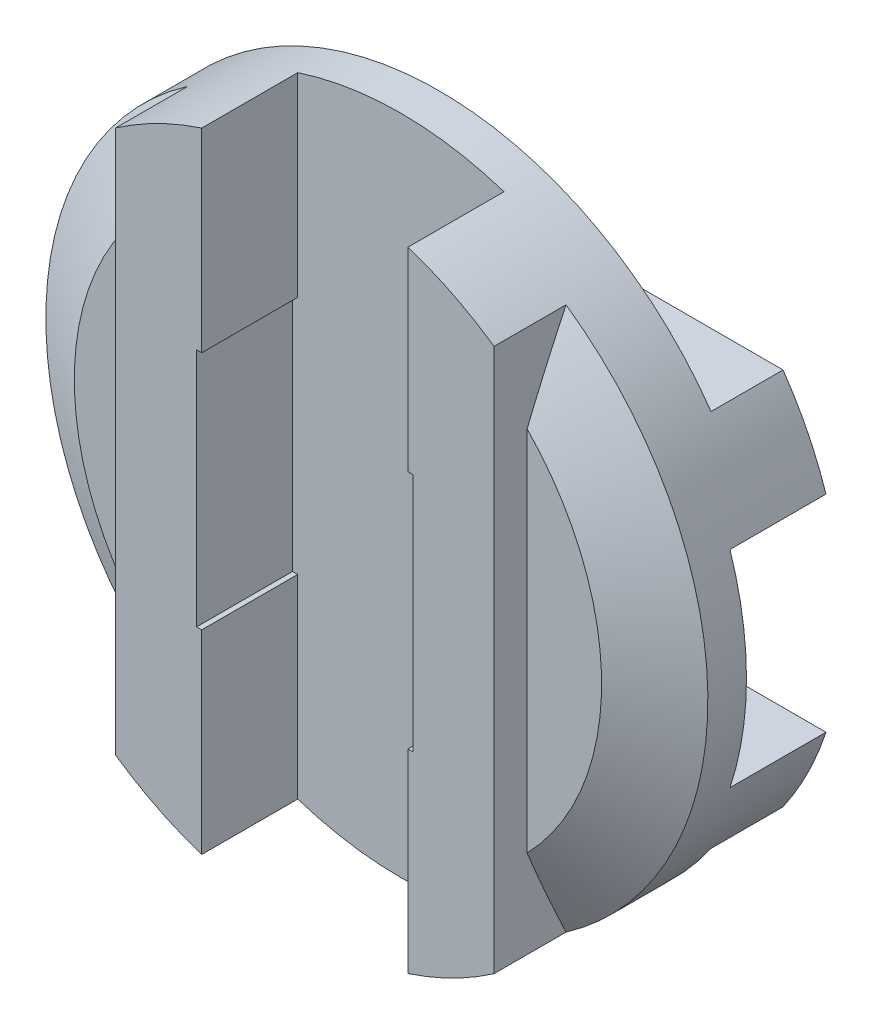
from build123d import *
from OCP.BRepFilletAPI import BRepFilletAPI_MakeChamfer

# Parameters (mm, degrees)
SKETCH1_R           = 12.7
BOSS_EXTRUDE1_DEPTH = 3.9624
SKETCH2_W           = 7.9121
SKETCH2_H           = 25.4
CUT_EXTRUDE1_DEPTH  = 3.683
SKETCH3_W           = 25.4
SKETCH3_H           = 7.9121
CUT_EXTRUDE2_DEPTH  = 3.683
SKETCH4_W           = 5.44195
SKETCH4_H           = 25.4
CUT_EXTRUDE3_DEPTH  = 1.27
SKETCH5_W           = 25.4
SKETCH5_H           = 5.44195
CUT_EXTRUDE4_DEPTH  = 1.27
CHAMFER1_SIZE       = 2.58492625
CHAMFER1_SIZE2      = 1.492407866
SKETCH6_W           = 8.307705
SKETCH6_H           = 9.2075
CUT_EXTRUDE5_DEPTH  = 3.683
SKETCH7_W           = 9.2075
SKETCH7_H           = 8.307705
CUT_EXTRUDE6_DEPTH  = 3.683


with BuildPart() as part:
    # Sketch1 → Boss-Extrude1 (new, symmetric)
    with BuildSketch(Plane.XY):
        Circle(SKETCH1_R)
    extrude(amount=BOSS_EXTRUDE1_DEPTH, both=True)

    # Sketch2 → Cut-Extrude1 (cut)
    with BuildSketch(Plane.XY.offset(3.9624)):
        Rectangle(SKETCH2_W, SKETCH2_H)
    extrude(amount=-CUT_EXTRUDE1_DEPTH, mode=Mode.SUBTRACT)

    # Sketch3 → Cut-Extrude2 (cut)
    with BuildSketch(Plane(origin=(0, 0, -3.9624), x_dir=(-1, 0, 0), z_dir=(0, 0, -1))):
        Rectangle(SKETCH3_W, SKETCH3_H)
    extrude(amount=-CUT_EXTRUDE2_DEPTH, mode=Mode.SUBTRACT)

    # Sketch4 → Cut-Extrude3 (cut)
    with BuildSketch(Plane.XY.offset(3.9624)):
        with Locations((9.979025, 0)):
            Rectangle(SKETCH4_W, SKETCH4_H)
        with Locations((-9.979025, 0)):
            Rectangle(SKETCH4_W, SKETCH4_H)
    extrude(amount=-CUT_EXTRUDE3_DEPTH, mode=Mode.SUBTRACT)

    # Sketch5 → Cut-Extrude4 (cut)
    with BuildSketch(Plane(origin=(0, 0, -3.9624), x_dir=(-1, 0, 0), z_dir=(0, 0, -1))):
        with Locations((0, 9.979025)):
            Rectangle(SKETCH5_W, SKETCH5_H)
        with Locations((0, -9.979025)):
            Rectangle(SKETCH5_W, SKETCH5_H)
    extrude(amount=-CUT_EXTRUDE4_DEPTH, mode=Mode.SUBTRACT)

    # Chamfer1: one chamfer whose edges measure the first distance from different faces: ONE call of the kernel's chamfer builder (chamfer() names one face for all edges)
    chamfer1_edges_1 = [part.edges().sort_by_distance(p)[0] for p in [
        (0, 12.7, -2.6924),
    ]]
    chamfer1_side_1 = [part.faces().sort_by_distance(p)[0] for p in [
        (0, 9.480522033, -2.6924),
    ]]
    chamfer1_edges_2 = [part.edges().sort_by_distance(p)[0] for p in [
        (0, -12.7, -2.6924),
    ]]
    chamfer1_side_2 = [part.faces().sort_by_distance(p)[0] for p in [
        (0, -9.480522033, -2.6924),
    ]]
    chamfer1_edges_3 = [part.edges().sort_by_distance(p)[0] for p in [
        (11.257602653, -5.8784677, 2.6924),
    ]]
    chamfer1_side_3 = [part.faces().sort_by_distance(p)[0] for p in [
        (9.480522033, 0, 2.6924),
    ]]
    chamfer1_edges_4 = [part.edges().sort_by_distance(p)[0] for p in [
        (-12.7, 0, 2.6924),
    ]]
    chamfer1_side_4 = [part.faces().sort_by_distance(p)[0] for p in [
        (-9.480522033, 0, 2.6924),
    ]]
    chamfer1 = BRepFilletAPI_MakeChamfer(part.part.solid().wrapped)
    for e in chamfer1_edges_1:
        chamfer1.Add(CHAMFER1_SIZE, CHAMFER1_SIZE2, e.wrapped, chamfer1_side_1[0].wrapped)  # the first distance lies on this face
    for e in chamfer1_edges_2:
        chamfer1.Add(CHAMFER1_SIZE, CHAMFER1_SIZE2, e.wrapped, chamfer1_side_2[0].wrapped)  # the first distance lies on this face
    for e in chamfer1_edges_3:
        chamfer1.Add(CHAMFER1_SIZE, CHAMFER1_SIZE2, e.wrapped, chamfer1_side_3[0].wrapped)  # the first distance lies on this face
    for e in chamfer1_edges_4:
        chamfer1.Add(CHAMFER1_SIZE, CHAMFER1_SIZE2, e.wrapped, chamfer1_side_4[0].wrapped)  # the first distance lies on this face
    add(Compound.cast(chamfer1.Shape()), mode=Mode.REPLACE)

    # Sketch6 → Cut-Extrude5 (cut)
    with BuildSketch(Plane.XY.offset(3.9624)):
        Rectangle(SKETCH6_W, SKETCH6_H)
    extrude(amount=-CUT_EXTRUDE5_DEPTH, mode=Mode.SUBTRACT)

    # Sketch7 → Cut-Extrude6 (cut)
    with BuildSketch(Plane(origin=(0, 0, -3.9624), x_dir=(-1, 0, 0), z_dir=(0, 0, -1))):
        Rectangle(SKETCH7_W, SKETCH7_H)
    extrude(amount=-CUT_EXTRUDE6_DEPTH, mode=Mode.SUBTRACT)


solid = part.part
